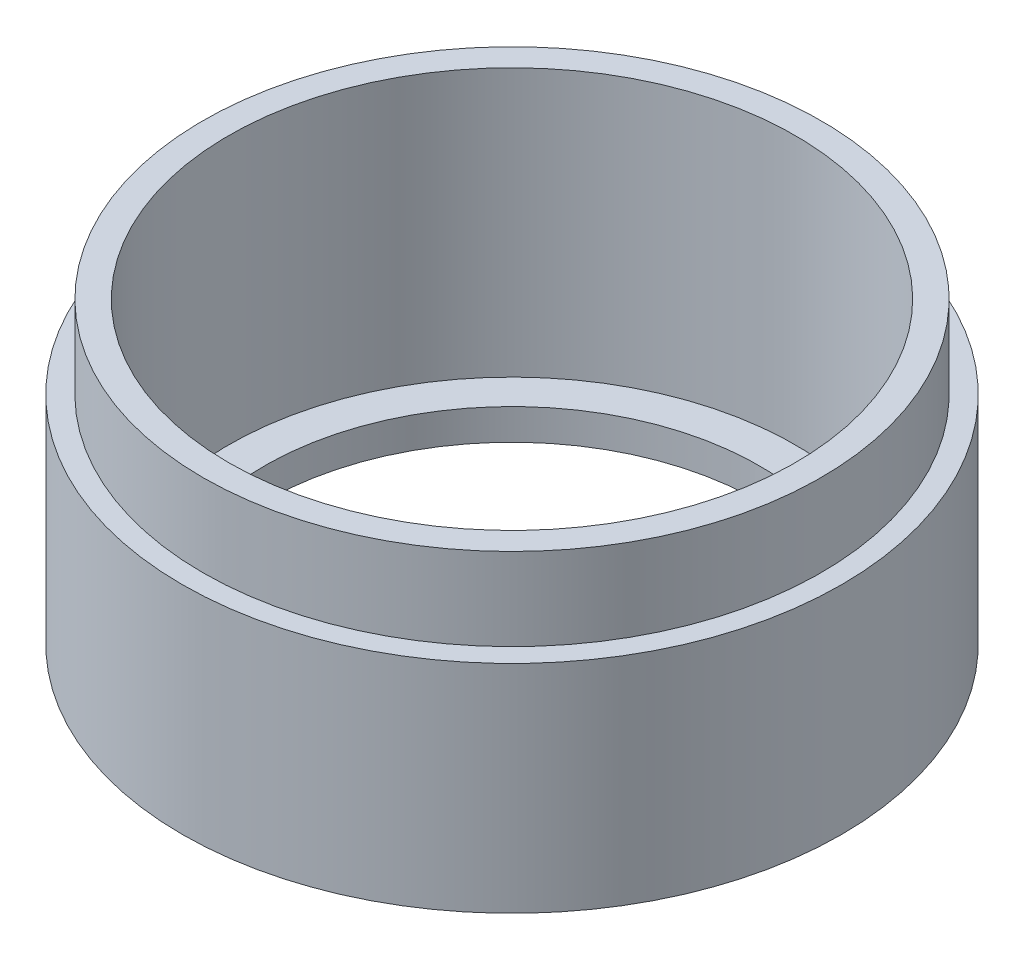
from build123d import *


with BuildPart() as part:
    # Эскиз1 → Повернуть1 (revolve)
    with BuildSketch(Plane.XY, mode=Mode.PRIVATE) as revolve_1_sk:
        Polygon((27.5, -20.494369949), (30, -20.494369949), (30, -28.494369949), (32, -28.494369949), (32, -49.494369949), (24, -49.494369949), (24, -46.494369949), (27.5, -46.494369949), align=None)
    revolve(revolve_1_sk.sketch.rotate(Axis((0, 46.025193798, 0), (0, -1, 0)), 90), axis=Axis((0, 46.025193798, 0), (0, -1, 0)))


solid = part.part
